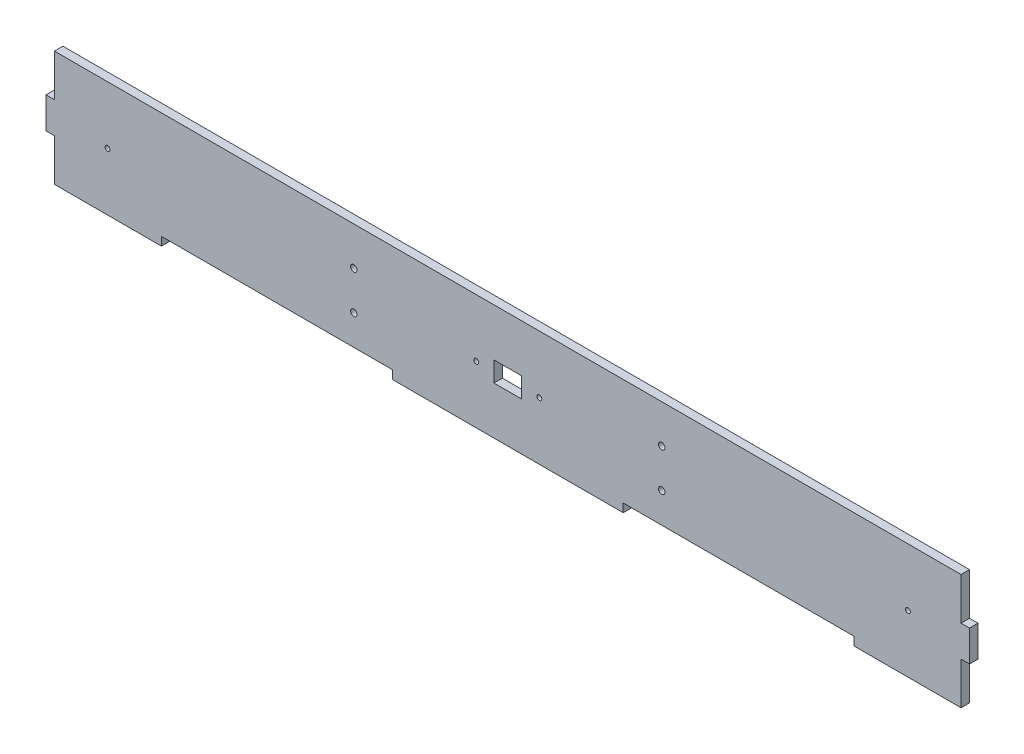
from build123d import *

# Parameters (mm, degrees)
BOSS_EXTRUDE1_DEPTH     = 5.5
CUT_EXTRUDE1_DEPTH      = 907.379197687
CUT_EXTRUDE1_DEPTH_BACK = 907.379197687
SKETCH2_R               = 1.6
SKETCH2_W               = 18
SKETCH2_H               = 13
SKETCH3_R               = 2.1
CUT_EXTRUDE2_DEPTH      = 907.379197687
SKETCH4_R               = 1.6
CUT_EXTRUDE3_DEPTH      = 907.379197687
SKETCH5_W               = 3.25
SKETCH5_H               = 9.45
SKETCH5_H_2             = 2.65
SKETCH5_W_2             = 1.25
SKETCH5_H_3             = 3.25
BOSS_EXTRUDE2_DEPTH     = 5.5


with BuildPart() as part:
    # Sketch1 → Boss-Extrude1 (new body)
    with BuildSketch(Plane.XY):
        Polygon((308.5, 78), (308.5, 50.625), (303, 50.625), (303, 42.125), (306.25, 42.125), (306.25, 40.5), (306.25, 38.875), (303, 38.875), (303, 30.375), (308.5, 30.375), (308.5, 3), (378, 3), (378, 8.5), (451.375, 8.5), (451.375, 17.95), (450.125, 17.95), (450.125, 20.6), (451.375, 20.6), (451.375, 23.25), (454.625, 23.25), (454.625, 20.6), (455.875, 20.6), (455.875, 17.95), (454.625, 17.95), (454.625, 8.5), (528, 8.5), (528, 3), (678, 3), (678, 8.5), (751.375, 8.5), (751.375, 17.95), (750.125, 17.95), (750.125, 20.6), (751.375, 20.6), (751.375, 23.25), (754.625, 23.25), (754.625, 20.6), (755.875, 20.6), (755.875, 17.95), (754.625, 17.95), (754.625, 8.5), (828, 8.5), (828, 3), (897.5, 3), (897.5, 30.375), (903, 30.375), (903, 38.875), (899.75, 38.875), (899.75, 40.5), (899.75, 42.125), (903, 42.125), (903, 50.625), (897.5, 50.625), (897.5, 78), align=None)
    extrude(amount=BOSS_EXTRUDE1_DEPTH)

    # Sketch2 → Cut-Extrude1 (cut, two sides: drawn at the far end of the back side and taken through both)
    with BuildSketch(Plane.XY.offset(5.5).offset(-CUT_EXTRUDE1_DEPTH_BACK)):
        with Locations((582.5, 40.5)):
            Circle(SKETCH2_R)
        with Locations((623.5, 40.5)):
            Circle(SKETCH2_R)
        with Locations((603, 40.5)):
            Rectangle(SKETCH2_W, SKETCH2_H)
    extrude(amount=CUT_EXTRUDE1_DEPTH + CUT_EXTRUDE1_DEPTH_BACK, mode=Mode.SUBTRACT)

    # Sketch3 → Cut-Extrude2 (cut, through all)
    with BuildSketch(Plane.XY.offset(5.5)):
        with Locations((503, 53)):
            Circle(SKETCH3_R)
        with Locations((503, 28)):
            Circle(SKETCH3_R)
        with Locations((703, 28)):
            Circle(SKETCH3_R)
        with Locations((703, 53)):
            Circle(SKETCH3_R)
    extrude(amount=-CUT_EXTRUDE2_DEPTH, mode=Mode.SUBTRACT)

    # Sketch4 → Cut-Extrude3 (cut, through all)
    with BuildSketch(Plane.XY.offset(5.5)):
        with Locations((343, 40.5)):
            Circle(SKETCH4_R)
        with Locations((863, 40.5)):
            Circle(SKETCH4_R)
    extrude(amount=-CUT_EXTRUDE3_DEPTH, mode=Mode.SUBTRACT)

    # Sketch5 → Boss-Extrude2 (add)
    with BuildSketch(Plane.XY.offset(5.5)):
        with Locations((753, 13.225)):
            Rectangle(SKETCH5_W, SKETCH5_H)
        with Locations((753, 19.275)):
            Rectangle(SKETCH5_W, SKETCH5_H_2)
        with Locations((750.75, 19.275)):
            Rectangle(SKETCH5_W_2, SKETCH5_H_2)
        with Locations((753, 21.925)):
            Rectangle(SKETCH5_W, SKETCH5_H_2)
        with Locations((755.25, 19.275)):
            Rectangle(SKETCH5_W_2, SKETCH5_H_2)
        with Locations((901.375, 40.5)):
            Rectangle(SKETCH5_W, SKETCH5_H_3)
        with Locations((453, 13.225)):
            Rectangle(SKETCH5_W, SKETCH5_H)
        with Locations((453, 19.275)):
            Rectangle(SKETCH5_W, SKETCH5_H_2)
        with Locations((453, 21.925)):
            Rectangle(SKETCH5_W, SKETCH5_H_2)
        with Locations((450.75, 19.275)):
            Rectangle(SKETCH5_W_2, SKETCH5_H_2)
        with Locations((455.25, 19.275)):
            Rectangle(SKETCH5_W_2, SKETCH5_H_2)
        with Locations((304.625, 40.5)):
            Rectangle(SKETCH5_W, SKETCH5_H_3)
    extrude(amount=-BOSS_EXTRUDE2_DEPTH)


solid = part.part
